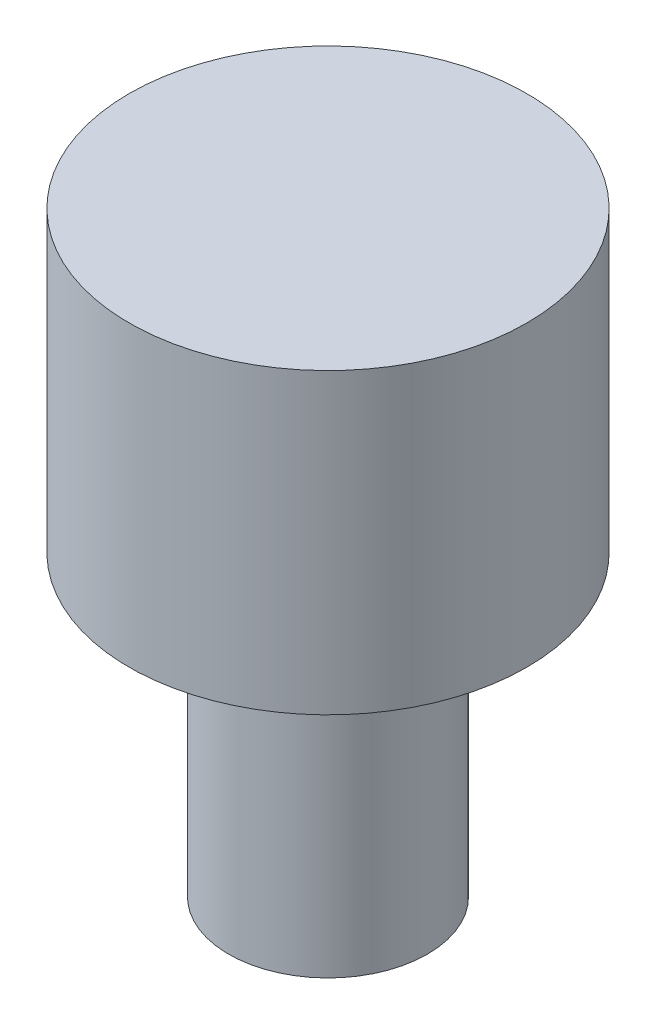
from build123d import *


with BuildPart() as part:
    # Sketch1 → Revolve1 (revolve)
    with BuildSketch(Plane.XY, mode=Mode.PRIVATE) as revolve1_sk:
        Polygon((0, 30), (-20, 30), (-20, 0), (-10, 0), (-10, -30), (0, -30), align=None)
    revolve(revolve1_sk.sketch.rotate(Axis((0, -30, 0), (0, 1, 0)), 180), axis=Axis((0, -30, 0), (0, 1, 0)))


solid = part.part
